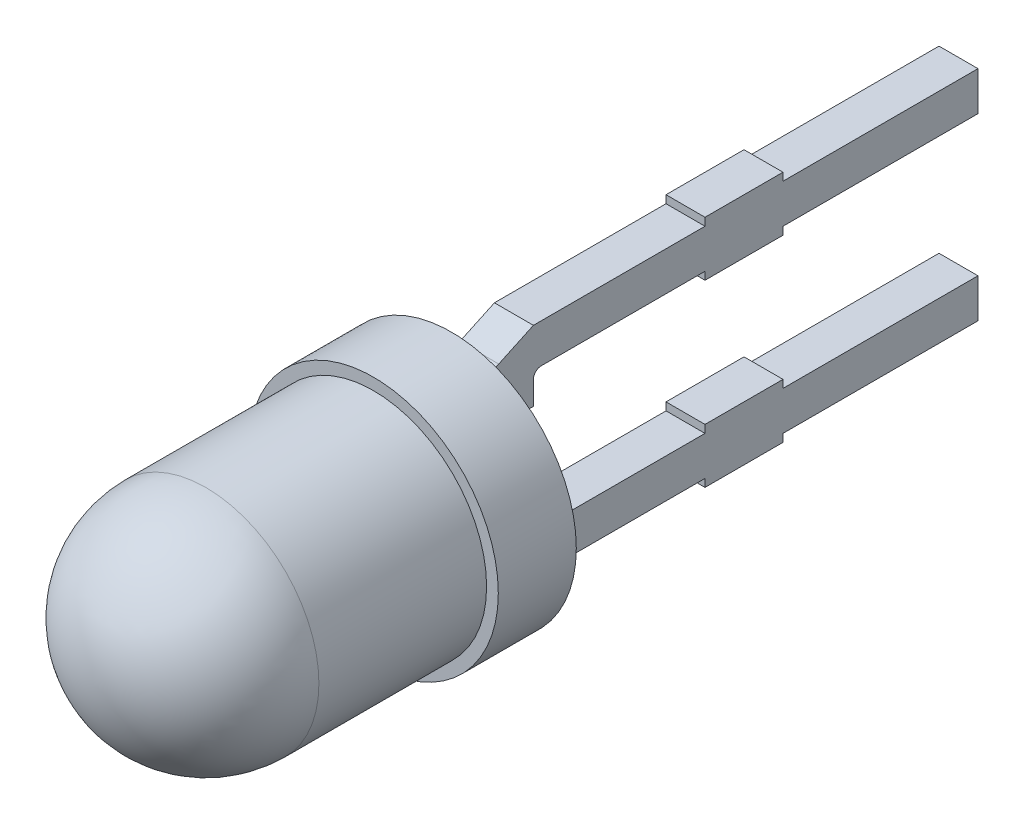
from build123d import *

# Parameters (mm, degrees)
EXTRUDE1_DEPTH          = 0.25
FILLET1_R               = 0.25
CUT_EXTRUDE1_DEPTH      = 31.234789562
CUT_EXTRUDE1_DEPTH_BACK = 31.234789562
SKETCH3_W               = 12
SKETCH3_H               = 2.8
CUT_EXTRUDE2_DEPTH      = 19.290502996
CUT_EXTRUDE2_DEPTH_BACK = 19.290502996
SKETCH4_W               = 9.390361913
SKETCH4_H               = 5.034183192


with BuildPart() as part:
    # Sketch1 → Revolve1 (revolve)
    with BuildSketch(Plane(origin=(0, 0, 0), x_dir=(0, 0, -1), z_dir=(1, 0, 0)), mode=Mode.PRIVATE) as revolve1_sk:
        with BuildLine():
            Line((0, 1.45), (2.15, 1.45))
            Line((2.15, 1.45), (2.15, 1.599999975))
            Line((2.15, 1.599999975), (3.15, 1.599999975))
            Line((3.15, 1.599999975), (3.15, 0))
            Line((3.15, 0), (-1.45, 0))
            ThreePointArc((-1.45, 0), (-1.025304833, 1.025304833), (0, 1.45))
        make_face()
    revolve(revolve1_sk.sketch.rotate(Axis((0, 0, 0), (0, 0, -1)), 90), axis=Axis((0, 0, 0), (0, 0, -1)))

    # Sketch2 → Extrude1 (add, symmetric)
    with BuildSketch(Plane(origin=(0, 0, 0), x_dir=(0, 0, -1), z_dir=(1, 0, 0))):
        with BuildLine():
            Line((3.15, 1.026953873), (3.95, 1.4))
            Line((3.95, 1.4), (6.15, 1.4))
            Line((6.15, 1.4), (6.15, 1.5))
            Line((6.15, 1.5), (7.15, 1.5))
            Line((7.15, 1.5), (7.15, 1.4))
            Line((7.15, 1.4), (30.15, 1.4))
            Line((30.15, 1.4), (30.15, 0.9))
            Line((30.15, 0.9), (7.15, 0.9))
            Line((7.15, 0.9), (7.15, 0.8))
            Line((7.15, 0.8), (6.15, 0.8))
            Line((6.15, 0.8), (6.15, 0.9))
            Line((6.15, 0.9), (4.05, 0.9))
            ThreePointArc((4.05, 0.9), (3.979289322, 0.870710678), (3.95, 0.8))
            Line((3.95, 0.8), (3.95, 0.5))
            Line((3.95, 0.5), (3.15, 0.5))
            Line((3.15, 0.5), (3.15, 1.026953873))
        make_face()
        with BuildLine():
            Line((3.95, -0.8), (3.95, -0.5))
            Line((3.95, -0.5), (3.15, -0.5))
            Line((3.15, -0.5), (3.15, -1.026953873))
            Line((3.15, -1.026953873), (3.95, -1.4))
            Line((3.95, -1.4), (6.15, -1.4))
            Line((6.15, -1.4), (6.15, -1.5))
            Line((6.15, -1.5), (7.15, -1.5))
            Line((7.15, -1.5), (7.15, -1.4))
            Line((7.15, -1.4), (30.15, -1.4))
            Line((30.15, -1.4), (30.15, -0.9))
            Line((30.15, -0.9), (7.15, -0.9))
            Line((7.15, -0.9), (7.15, -0.8))
            Line((7.15, -0.8), (6.15, -0.8))
            Line((6.15, -0.8), (6.15, -0.9))
            Line((6.15, -0.9), (4.05, -0.9))
            ThreePointArc((4.05, -0.9), (3.979289322, -0.870710678), (3.95, -0.8))
        make_face()
    extrude(amount=EXTRUDE1_DEPTH, both=True)

    # Fillet1
    fillet1_edges = [part.edges().sort_by_distance(p)[0] for p in [
        (-0.25, 0.763476937, -3.15),
        (0, 1.026953873, -3.15),
        (0, 0.5, -3.15),
        (0.25, 0.763476937, -3.15),
        (-0.25, -0.763476937, -3.15),
        (0, -0.5, -3.15),
        (0, -1.026953873, -3.15),
        (0.25, -0.763476937, -3.15),
    ]]
    fillet(fillet1_edges, radius=FILLET1_R)

    # Sketch3 → Cut-Extrude1 (cut, two sides: drawn at the far end of the back side and taken through both)
    with BuildSketch(Plane(origin=(0, 0, 0), x_dir=(0, 0, -1), z_dir=(1, 0, 0)).offset(-CUT_EXTRUDE1_DEPTH_BACK)):
        with Locations((24.15, 0)):
            Rectangle(SKETCH3_W, SKETCH3_H)
    extrude(amount=CUT_EXTRUDE1_DEPTH + CUT_EXTRUDE1_DEPTH_BACK, mode=Mode.SUBTRACT)

    # Sketch4 → Cut-Extrude2 (cut, two sides: drawn at the far end of the back side and taken through both)
    with BuildSketch(Plane(origin=(0, 0, 0), x_dir=(0, 0, -1), z_dir=(1, 0, 0)).offset(-CUT_EXTRUDE2_DEPTH_BACK)):
        with Locations((14.345180957, 0.016950112)):
            Rectangle(SKETCH4_W, SKETCH4_H)
    extrude(amount=CUT_EXTRUDE2_DEPTH + CUT_EXTRUDE2_DEPTH_BACK, mode=Mode.SUBTRACT)


solid = part.part
